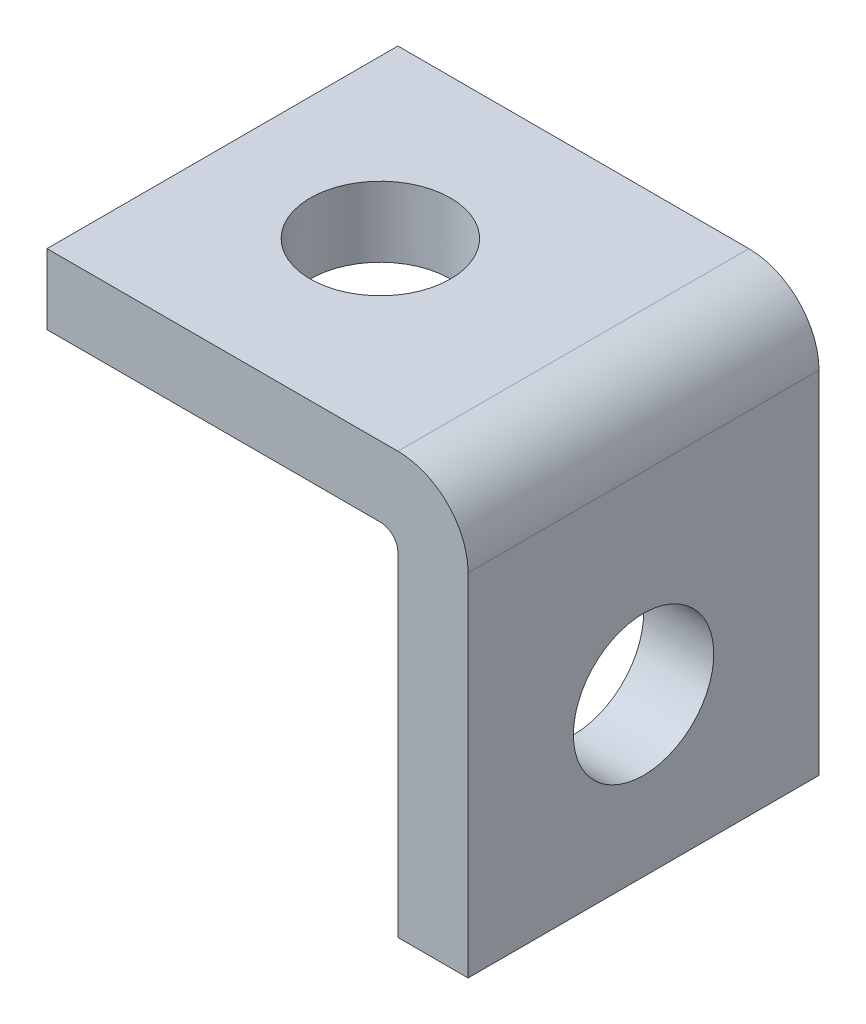
from build123d import *

# Parameters (mm, degrees)
BOSS_EXTRU_2_DEPTH      = 10
ENL_V_MAT_EXTRU_1_REACH = 20.547
ESQUISSE3_R             = 2
ENL_V_MAT_EXTRU_2_REACH = 20.547
ESQUISSE4_R             = 2
CONG_1_R                = 2
CONG_2_R                = 0.5


with BuildPart() as part:
    # Esquisse2 → Boss.-Extru.2 (new body)
    with BuildSketch(Plane.XY):
        Polygon((0, 12), (12, 12), (12, 0), (10, 0), (10, 10), (0, 10), align=None)
    extrude(amount=BOSS_EXTRU_2_DEPTH)

    # Esquisse3 → Enlèv. mat.-Extru.1 (cut, up to next)
    with BuildSketch(Plane.ZY.offset(-10), mode=Mode.PRIVATE) as enl_v_mat_extru_1_sk1:
        with Locations(Location((5, 4.5, 0), (0, 0, 270))):
            Circle(ESQUISSE3_R)
    enl_v_mat_extru_1_tool1 = extrude(enl_v_mat_extru_1_sk1.sketch, amount=-ENL_V_MAT_EXTRU_1_REACH, mode=Mode.PRIVATE) & part.part
    add(enl_v_mat_extru_1_tool1.solids().sort_by_distance((10, 4.5, 5))[0], mode=Mode.SUBTRACT)

    # Esquisse4 → Enlèv. mat.-Extru.2 (cut, up to next)
    with BuildSketch(Plane.XZ.offset(-10), mode=Mode.PRIVATE) as enl_v_mat_extru_2_sk1:
        with Locations((4.5, 5)):
            Circle(ESQUISSE4_R)
    enl_v_mat_extru_2_tool1 = extrude(enl_v_mat_extru_2_sk1.sketch, amount=-ENL_V_MAT_EXTRU_2_REACH, mode=Mode.PRIVATE) & part.part
    add(enl_v_mat_extru_2_tool1.solids().sort_by_distance((4.5, 10, 5))[0], mode=Mode.SUBTRACT)

    # Congé1
    cong_1_edges = [part.edges().sort_by_distance(p)[0] for p in [
        (12, 12, 5),
    ]]
    fillet(cong_1_edges, radius=CONG_1_R)

    # Congé2
    cong_2_edges = [part.edges().sort_by_distance(p)[0] for p in [
        (10, 10, 5),
    ]]
    fillet(cong_2_edges, radius=CONG_2_R)


solid = part.part
